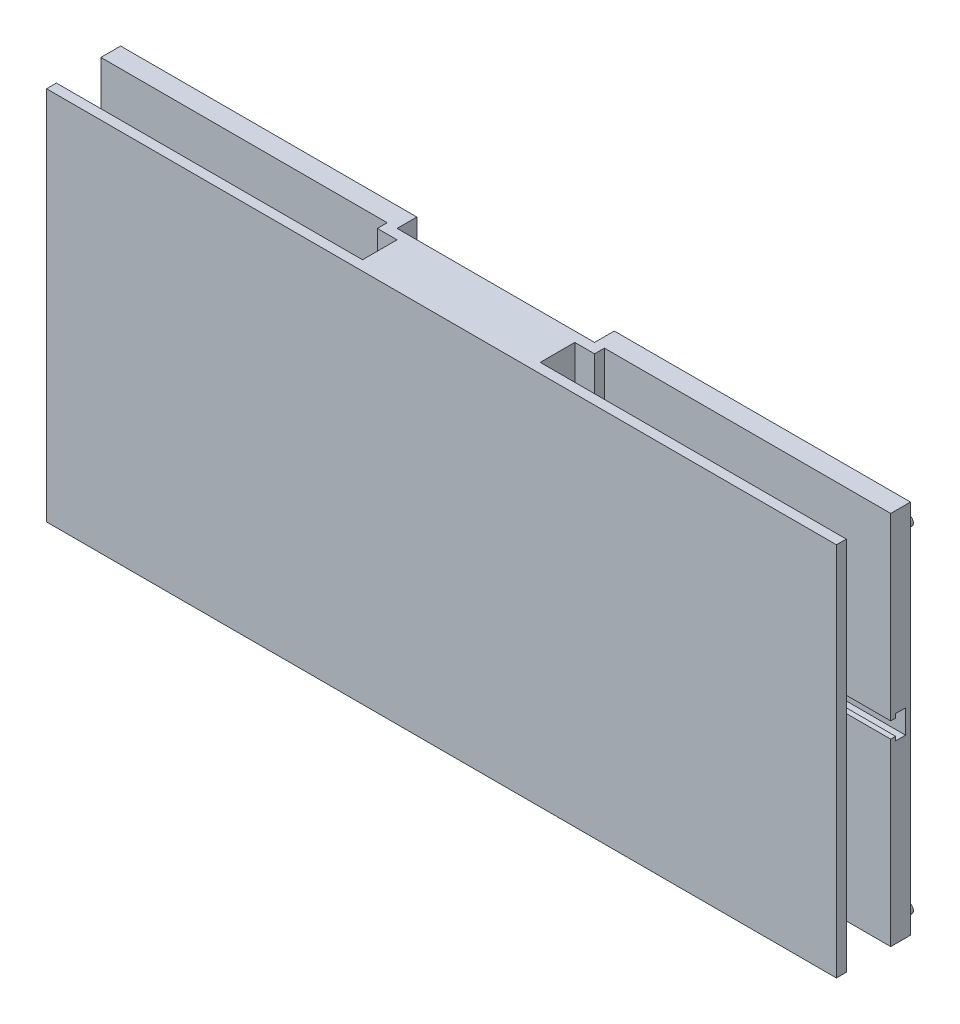
from build123d import *

# Parameters (mm, degrees)
SKETCH1_W           = 30
SKETCH1_H           = 38
BOSS_EXTRUDE1_DEPTH = 2
SKETCH2_R           = 0.5
BOSS_EXTRUDE2_DEPTH = 0.8
SKETCH5_W           = 1
SKETCH5_H           = 38
BOSS_EXTRUDE4_DEPTH = 1
SKETCH6_W           = 1
SKETCH6_H           = 38
BOSS_EXTRUDE5_DEPTH = 20
SKETCH8_W           = 18
SKETCH8_H           = 38
BOSS_EXTRUDE6_DEPTH = 3.5
CUT_EXTRUDE1_DEPTH  = 29
SKETCH12_W          = 80
SKETCH12_H          = 38
BOSS_EXTRUDE7_DEPTH = 1


with BuildPart() as part:
    # Sketch1 → Boss-Extrude1 (new body)
    with BuildSketch(Plane.XY):
        Rectangle(SKETCH1_W, SKETCH1_H)
    extrude(amount=BOSS_EXTRUDE1_DEPTH)

    # Sketch2 → Boss-Extrude2 (add)
    with BuildSketch(Plane(origin=(0, 0, 0), x_dir=(-1, 0, 0), z_dir=(0, 0, -1))):
        with Locations(Location((14, 16.5, 0), (0, 0, 180))):
            Circle(SKETCH2_R)
        with Locations(Location((14, -17.5, 0), (0, 0, 180))):
            Circle(SKETCH2_R)
    extrude(amount=BOSS_EXTRUDE2_DEPTH)

    # Sketch5 → Boss-Extrude4 (add)
    with BuildSketch(Plane.XY.offset(2)):
        with Locations((14.5, 0)):
            Rectangle(SKETCH5_W, SKETCH5_H)
    extrude(amount=BOSS_EXTRUDE4_DEPTH)

    # Sketch6 → Boss-Extrude5 (add)
    with BuildSketch(Plane(origin=(15, 0, 0), x_dir=(0, 0, -1), z_dir=(1, 0, 0))):
        with Locations((-2.5, 0)):
            Rectangle(SKETCH6_W, SKETCH6_H)
    extrude(amount=BOSS_EXTRUDE5_DEPTH)

    # Mirror2: part across plane


with BuildPart() as part_1:
    add(part.part)
    add(part.part.mirror(Plane(origin=(25, 0, 0), x_dir=(0, 0, 1), z_dir=(1, 0, 0))))

    # Sketch8 → Boss-Extrude6 (add)
    with BuildSketch(Plane.XY.offset(3)):
        with Locations((25, 0)):
            Rectangle(SKETCH8_W, SKETCH8_H)
    extrude(amount=BOSS_EXTRUDE6_DEPTH)

    # Sketch9 → Cut-Extrude1 (cut)
    with BuildSketch(Plane.ZY.offset(15)):
        Polygon((2, -0.8), (2, 0.8), (1.5, 0.8), (1.5, 1.2), (0.5, 1.2), (0.5, -1.2), (1.5, -1.2), (1.5, -0.8), align=None)
    cut_extrude1 = extrude(amount=-CUT_EXTRUDE1_DEPTH, mode=Mode.SUBTRACT)

    # Mirror3: Cut-Extrude1 across plane
    add(cut_extrude1.mirror(Plane(origin=(25, 0, 0), x_dir=(0, 0, 1), z_dir=(1, 0, 0))), mode=Mode.SUBTRACT)

    # Sketch12 → Boss-Extrude7 (add)
    with BuildSketch(Plane.XY.offset(6.5)):
        with Locations((25, 0)):
            Rectangle(SKETCH12_W, SKETCH12_H)
    extrude(amount=BOSS_EXTRUDE7_DEPTH)


solid = part_1.part
